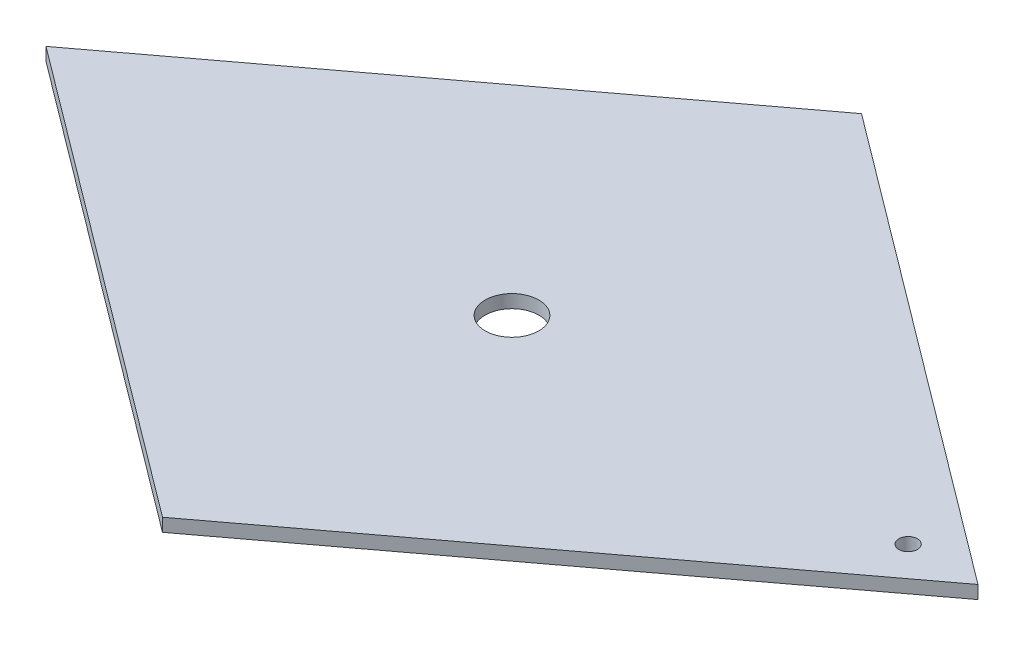
from build123d import *

# Parameters (mm, degrees)
SKETCH1_R           = 11.5
SKETCH1_R_2         = 4
BOSS_EXTRUDE1_DEPTH = 5.63


with BuildPart() as part:
    # Sketch1 → Boss-Extrude1 (new body)
    with BuildSketch(Plane(origin=(0, 0, 0), x_dir=(1, 0, 0), z_dir=(0, 1, 0))):
        Polygon((0, 150), (200, 0), (0, -150), (-200, 0), align=None)
        with Locations(Location((0, 0, 0), (0, 0, 270))):
            Circle(SKETCH1_R, mode=Mode.SUBTRACT)
        with Locations(Location((170, 0, 0), (0, 0, 270))):
            Circle(SKETCH1_R_2, mode=Mode.SUBTRACT)
    extrude(amount=BOSS_EXTRUDE1_DEPTH)


solid = part.part
